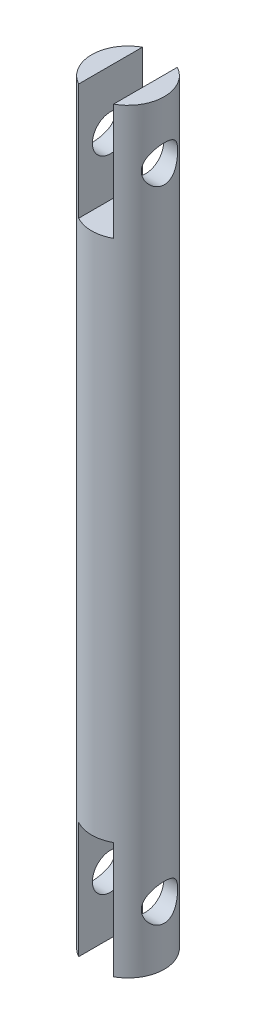
from build123d import *

# Parameters (mm, degrees)
SKETCH2_R               = 2.5
BOSS_EXTRUDE1_DEPTH     = 52
SKETCH3_W               = 2.4
SKETCH3_H               = 5
CUT_EXTRUDE1_DEPTH      = 8
CUT_EXTRUDE2_DEPTH      = 53.120053722
CUT_EXTRUDE2_DEPTH_BACK = 53.120053722
SKETCH4_R               = 1.25
SKETCH5_W               = 2.4
SKETCH5_H               = 5
CUT_EXTRUDE3_DEPTH      = 8


with BuildPart() as part:
    # Sketch2 → Boss-Extrude1 (new body)
    with BuildSketch(Plane(origin=(0, 0, 0), x_dir=(-1, 0, 0), z_dir=(0, 1, 0))):
        with Locations(Location((0, 0, 0), (0, 0, 270))):
            Circle(SKETCH2_R)
    extrude(amount=BOSS_EXTRUDE1_DEPTH)

    # Sketch3 → Cut-Extrude1 (cut)
    with BuildSketch(Plane.XZ):
        Rectangle(SKETCH3_W, SKETCH3_H)
    extrude(amount=-CUT_EXTRUDE1_DEPTH, mode=Mode.SUBTRACT)

    # Sketch4 → Cut-Extrude2 (cut, two sides: drawn at the far end of the back side and taken through both)
    with BuildSketch(Plane.YZ.offset(-CUT_EXTRUDE2_DEPTH_BACK)):
        with Locations(Location((4, 0, 0), (0, 0, 270))):
            Circle(SKETCH4_R)
        with Locations(Location((48, 0, 0), (0, 0, 270))):
            Circle(SKETCH4_R)
    extrude(amount=CUT_EXTRUDE2_DEPTH + CUT_EXTRUDE2_DEPTH_BACK, mode=Mode.SUBTRACT)

    # Sketch5 → Cut-Extrude3 (cut)
    with BuildSketch(Plane(origin=(0, 52, 0), x_dir=(-1, 0, 0), z_dir=(0, 1, 0))):
        Rectangle(SKETCH5_W, SKETCH5_H)
    extrude(amount=-CUT_EXTRUDE3_DEPTH, mode=Mode.SUBTRACT)


solid = part.part
